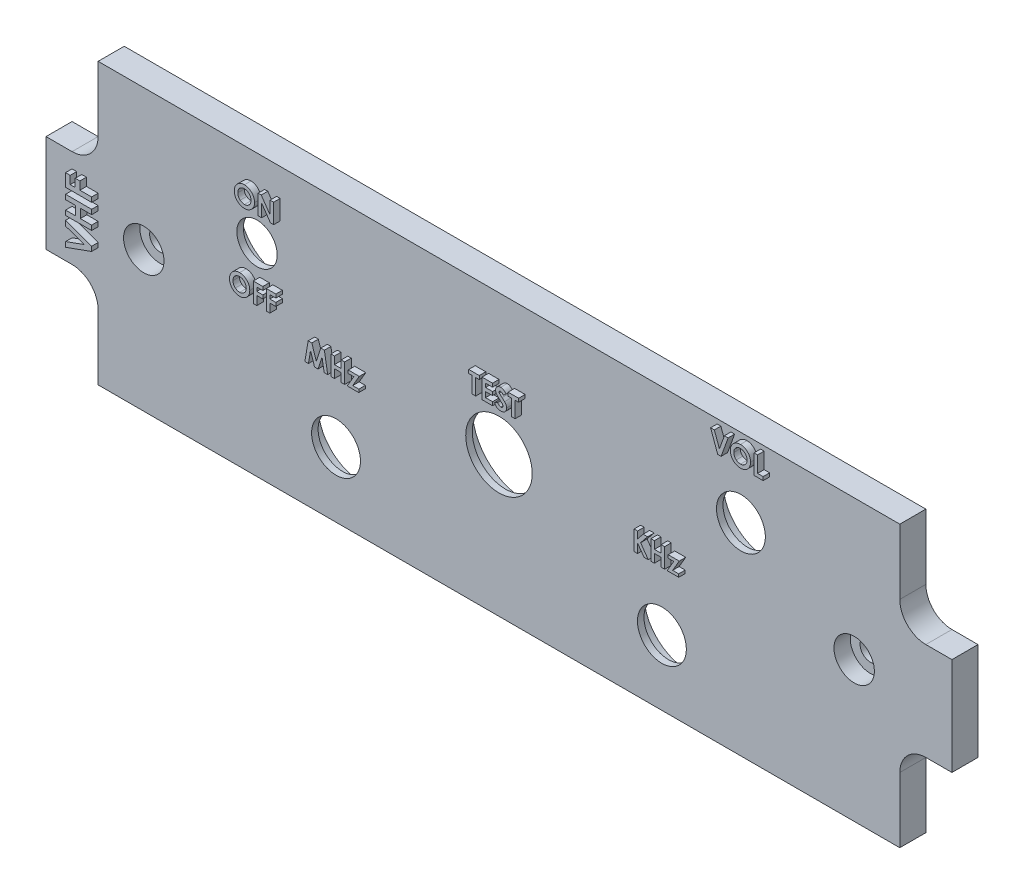
from build123d import *

# Parameters (mm, degrees)
SKETCH1_R            = 1.6
SKETCH1_R_2          = 3.75
SKETCH1_R_3          = 5.1
SKETCH1_R_4          = 3.1
BOSS_EXTRUDE1_DEPTH  = 4
SKETCH2_R            = 6.7
SKETCH2_R_2          = 6.75
SKETCH2_R_3          = 8.1
BACK_HOLES_DEPTH     = 3
SKETCH3_R            = 3.1
CAMA_TORNILLOS_DEPTH = 2.5
TEXTOS_DEPTH         = 1


with BuildPart() as part:
    # Sketch1 → Boss-Extrude1 (new body)
    with BuildSketch(Plane.XY):
        with BuildLine():
            Line((8, 0), (131, 0))
            Line((131, 0), (131, 10))
            ThreePointArc((131, 10), (132.171572875, 12.828427125), (135, 14))
            Line((135, 14), (139, 14))
            Line((139, 14), (139, 29))
            Line((139, 29), (135, 29))
            ThreePointArc((135, 29), (132.171572875, 30.171572875), (131, 33))
            Line((131, 33), (131, 43))
            Line((131, 43), (8, 43))
            Line((8, 43), (8, 33))
            ThreePointArc((8, 33), (6.828427125, 30.171572875), (4, 29))
            Line((4, 29), (0, 29))
            Line((0, 29), (0, 14))
            Line((0, 14), (4, 14))
            ThreePointArc((4, 14), (6.828427125, 12.828427125), (8, 10))
            Line((8, 10), (8, 0))
        make_face()
        with Locations((124, 21.5)):
            Circle(SKETCH1_R, mode=Mode.SUBTRACT)
        with Locations((106.624355653, 31)):
            Circle(SKETCH1_R_2, mode=Mode.SUBTRACT)
        with Locations((94.5, 10)):
            Circle(SKETCH1_R_2, mode=Mode.SUBTRACT)
        with Locations((69.5, 21.5)):
            Circle(SKETCH1_R_3, mode=Mode.SUBTRACT)
        with Locations((44.5, 10)):
            Circle(SKETCH1_R_2, mode=Mode.SUBTRACT)
        with Locations((32.375644347, 31)):
            Circle(SKETCH1_R_4, mode=Mode.SUBTRACT)
        with Locations((15, 21.5)):
            Circle(SKETCH1_R, mode=Mode.SUBTRACT)
    extrude(amount=BOSS_EXTRUDE1_DEPTH)

    # Sketch2 → Back holes (cut)
    with BuildSketch(Plane(origin=(0, 0, 0), x_dir=(-1, 0, 0), z_dir=(0, 0, -1))):
        with Locations((-32.375644347, 31)):
            Circle(SKETCH2_R)
        with Locations((-44.5, 10)):
            Circle(SKETCH2_R_2)
        with Locations((-69.5, 21.5)):
            Circle(SKETCH2_R_3)
        with Locations((-94.5, 10)):
            Circle(SKETCH2_R_2)
        with Locations((-106.624355653, 31)):
            Circle(SKETCH2_R_2)
    extrude(amount=-BACK_HOLES_DEPTH, mode=Mode.SUBTRACT)

    # Sketch3 → Cama tornillos (cut)
    with BuildSketch(Plane.XY.offset(4)):
        with Locations((124, 21.5)):
            Circle(SKETCH3_R)
        with Locations((15, 21.5)):
            Circle(SKETCH3_R)
    extrude(amount=-CAMA_TORNILLOS_DEPTH, mode=Mode.SUBTRACT)

    # Sketch4 → Textos (add)
    # profile 1 of 21: a face of its own
    with BuildSketch(Plane.XY.offset(4)):
        Polygon((4, 24.757985016), (4, 26.706702964), (4.717948718, 26.706702964), (4.717948718, 25.475933734), (5.487179487, 25.475933734), (5.487179487, 26.706702964), (6.205128205, 26.706702964), (6.205128205, 25.475933734), (8, 25.475933734), (8, 24.757985016), align=None)
    # profile 2 of 21: a face of its own
    with BuildSketch(Plane.XY.offset(4)):
        Polygon((4, 21.014395272), (4, 21.73234399), (5.538461538, 21.73234399), (5.538461538, 23.116959375), (4, 23.116959375), (4, 23.834908093), (8, 23.834908093), (8, 23.116959375), (6.256410256, 23.116959375), (6.256410256, 21.73234399), (8, 21.73234399), (8, 21.014395272), align=None)
    # profile 3 of 21: a face of its own
    with BuildSketch(Plane.XY.offset(4)):
        Polygon((4, 16.783626041), (4, 17.550452964), (6.841346154, 18.578497836), (4, 19.60734399), (4, 20.373369631), (8, 18.9238504), (8, 18.231542708), align=None)
    # profile 4 of 21: a face of its own
    with BuildSketch(Plane.XY.offset(4)):
        with BuildLine():
            add(Edge.make_bspline(
                [(30.712754657, 26.785286662), (30.764913334, 26.78393618), (30.867886376, 26.781270024), (31.01932256, 26.759045529), (31.165259325, 26.722833901), (31.305630677, 26.672497118), (31.440085143, 26.606671806), (31.569096989, 26.527224155), (31.6922041, 26.432654637), (31.808144973, 26.325169404), (31.915295251, 26.208283907), (32.008141029, 26.082435889), (32.087316502, 25.950886198), (32.152937346, 25.813282343), (32.202919833, 25.668671352), (32.237994611, 25.51779055), (32.260528419, 25.360682861), (32.263120153, 25.253713939), (32.26443735, 25.199349162)],
                knots=[0, 0, 0, 0, 1.014329547, 2.002516266, 2.970391464, 3.935626869, 4.897733899, 5.877609409, 6.878433252, 7.912639331, 8.949961323, 9.958554974, 10.949718813, 11.932905612, 12.9188844, 13.919928257, 14.942845884, 16, 16, 16, 16], degree=3))
            add(Edge.make_bspline(
                [(32.26443735, 25.199349162), (32.263034593, 25.14559695), (32.260270415, 25.039676493), (32.23891454, 24.884016613), (32.203249098, 24.734752058), (32.154114353, 24.591544966), (32.089683623, 24.455088981), (32.012052158, 24.324512852), (31.91917141, 24.201028356), (31.814429107, 24.084701759), (31.69911692, 23.979110412), (31.576983009, 23.886058219), (31.448591312, 23.807209303), (31.314129754, 23.742599779), (31.173309988, 23.692458707), (31.026479857, 23.657080538), (30.873648446, 23.63558051), (30.769715675, 23.632834387), (30.716961388, 23.631440508)],
                knots=[0, 0, 0, 0, 1.051557043, 2.072126891, 3.067553643, 4.050577992, 5.02905126, 6.015227836, 7.017913613, 8.04756643, 9.074058332, 10.072836633, 11.047628519, 12.017157415, 12.98668631, 13.966869689, 14.968021931, 16, 16, 16, 16], degree=3))
            add(Edge.make_bspline(
                [(30.716961388, 23.631440508), (30.661786729, 23.632690886), (30.553376066, 23.635147709), (30.394716576, 23.658510971), (30.242707075, 23.693704206), (30.09862453, 23.74622822), (29.961001585, 23.811887654), (29.830849395, 23.892751185), (29.708211699, 23.988685177), (29.593791969, 24.097232727), (29.490127416, 24.216007554), (29.398623114, 24.341482627), (29.321437206, 24.472699425), (29.258566866, 24.609719361), (29.209002417, 24.75169089), (29.174040329, 24.899478658), (29.153387389, 25.052728218), (29.150510555, 25.156818382), (29.149052734, 25.209565508)],
                knots=[0, 0, 0, 0, 1.067978421, 2.098431617, 3.099715153, 4.085208694, 5.062210972, 6.048429807, 7.046490867, 8.072918869, 9.098532598, 10.095778865, 11.076610158, 12.041847152, 13.011192615, 13.984257998, 14.978533688, 16, 16, 16, 16], degree=3))
            add(Edge.make_bspline(
                [(29.149052734, 25.209565508), (29.149510282, 25.245051013), (29.150419585, 25.315572694), (29.16137309, 25.420082226), (29.177142987, 25.522551873), (29.200465918, 25.622573086), (29.228797318, 25.720851468), (29.265504648, 25.81647222), (29.307287524, 25.910456835), (29.35610688, 26.001695236), (29.410389284, 26.089347954), (29.46961622, 26.173001516), (29.533936612, 26.251644428), (29.603143265, 26.325793498), (29.677474672, 26.39496134), (29.755953082, 26.460127121), (29.840100518, 26.519559806), (29.928075257, 26.574710859), (30.019381319, 26.624583), (30.113647003, 26.667032675), (30.208930251, 26.704103253), (30.30650392, 26.733360992), (30.405322332, 26.757191115), (30.506441163, 26.772950384), (30.608946862, 26.783903585), (30.67806994, 26.784824542), (30.712754657, 26.785286662)],
                knots=[0, 0, 0, 0, 1.034744296, 2.056386356, 3.06226378, 4.057406941, 5.050368692, 6.043467995, 7.042652155, 8.049140477, 9.059438543, 10.048523776, 11.036952808, 12.020949711, 13.004946614, 13.997082645, 14.994316842, 16.007702937, 17.024872941, 18.026463647, 19.021641123, 20.005082605, 20.995858141, 21.984425357, 22.988620895, 24, 24, 24, 24], degree=3))
        make_face()
        with BuildLine():
            add(Edge.make_bspline(
                [(30.704341196, 26.246825123), (30.669238413, 26.245883237), (30.599959568, 26.24402433), (30.498340118, 26.229861973), (30.400781857, 26.207243079), (30.307825589, 26.174479888), (30.219068435, 26.13278066), (30.134353054, 26.082291099), (30.05485258, 26.021275682), (29.97950695, 25.953010055), (29.911444573, 25.876946458), (29.851309315, 25.795431378), (29.80098579, 25.708600943), (29.758839522, 25.617261788), (29.727112724, 25.520386829), (29.704514676, 25.418734897), (29.690233554, 25.31213084), (29.688433401, 25.239458994), (29.687514273, 25.202353969)],
                knots=[0, 0, 0, 0, 1.033739768, 2.040188636, 3.016340934, 3.979330865, 4.937572243, 5.900995986, 6.878200029, 7.884839167, 8.891893314, 9.879764717, 10.863503415, 11.843163062, 12.837761627, 13.859916423, 14.907309254, 16, 16, 16, 16], degree=3))
            add(Edge.make_bspline(
                [(29.687514273, 25.202353969), (29.688732896, 25.161233255), (29.691121196, 25.080643469), (29.707925565, 24.96308126), (29.736676168, 24.852055422), (29.77819148, 24.748108966), (29.829681358, 24.650087643), (29.893623614, 24.559192845), (29.968982688, 24.474880335), (30.027038707, 24.42565518), (30.056504657, 24.400671277)],
                knots=[0, 0, 0, 0, 1.078454662, 2.113592447, 3.107694534, 4.079536787, 5.043276885, 6.005368276, 6.987637804, 8, 8, 8, 8], degree=3))
            add(Edge.make_bspline(
                [(30.056504657, 24.400671277), (30.080642896, 24.382214129), (30.128375535, 24.345715675), (30.204567219, 24.29893542), (30.28302965, 24.258840074), (30.364354927, 24.226443509), (30.448371294, 24.200960916), (30.53506723, 24.183115874), (30.624319894, 24.171916568), (30.684676728, 24.170578038), (30.715158504, 24.169902046)],
                knots=[0, 0, 0, 0, 1.023928204, 2.024787132, 3.009472467, 3.9914905, 4.972207045, 5.96565515, 6.972602802, 8, 8, 8, 8], degree=3))
            add(Edge.make_bspline(
                [(30.715158504, 24.169902046), (30.749657693, 24.170851919), (30.817535933, 24.172720823), (30.917263682, 24.186708834), (31.012805894, 24.210381598), (31.104755705, 24.242857379), (31.19284797, 24.285080176), (31.276652161, 24.337135765), (31.356315207, 24.39838497), (31.431564847, 24.467547074), (31.500346575, 24.543910309), (31.560356343, 24.625860183), (31.612279905, 24.711591093), (31.65354974, 24.802316432), (31.686529993, 24.897179794), (31.708856061, 24.99660131), (31.723257827, 25.100171124), (31.725058487, 25.170654044), (31.725975811, 25.2065607)],
                knots=[0, 0, 0, 0, 1.026359118, 2.019393844, 2.989460624, 3.950973911, 4.916101784, 5.890408035, 6.881132271, 7.902007068, 8.92769091, 9.933912415, 10.920395702, 11.90457117, 12.894218921, 13.903490204, 14.931958862, 16, 16, 16, 16], degree=3))
            add(Edge.make_bspline(
                [(31.725975811, 25.2065607), (31.725026747, 25.242260883), (31.72315866, 25.31253125), (31.70914603, 25.415834787), (31.685623392, 25.514817386), (31.653050089, 25.609640694), (31.611455707, 25.700397674), (31.560020034, 25.786769171), (31.498923551, 25.868671684), (31.42957239, 25.945547079), (31.354087914, 26.016190643), (31.273047786, 26.077496415), (31.188719601, 26.130769182), (31.099168458, 26.172500916), (31.006226499, 26.2057485), (30.909326588, 26.230232498), (30.808101708, 26.243924838), (30.73923633, 26.245849744), (30.704341196, 26.246825123)],
                knots=[0, 0, 0, 0, 1.055025985, 2.07665775, 3.074803781, 4.057872707, 5.035505728, 6.020516407, 7.023567878, 8.050795229, 9.077271434, 10.074415901, 11.050397877, 12.019801805, 12.988065821, 13.964604439, 14.968634123, 16, 16, 16, 16], degree=3))
        make_face(mode=Mode.SUBTRACT)
    # profile 5 of 21: a face of its own
    with BuildSketch(Plane.XY.offset(4)):
        Polygon((32.802898888, 26.708363585), (34.26443735, 26.708363585), (34.26443735, 26.169902046), (33.341360427, 26.169902046), (33.341360427, 25.592978969), (34.26443735, 25.592978969), (34.26443735, 25.054517431), (33.341360427, 25.054517431), (33.341360427, 23.708363585), (32.802898888, 23.708363585), align=None)
    # profile 6 of 21: a face of its own
    with BuildSketch(Plane.XY.offset(4)):
        Polygon((34.802898888, 26.708363585), (36.26443735, 26.708363585), (36.26443735, 26.169902046), (35.341360427, 26.169902046), (35.341360427, 25.592978969), (36.26443735, 25.592978969), (36.26443735, 25.054517431), (35.341360427, 25.054517431), (35.341360427, 23.708363585), (34.802898888, 23.708363585), align=None)
    # profile 7 of 21: a face of its own
    with BuildSketch(Plane.XY.offset(4)):
        with BuildLine():
            add(Edge.make_bspline(
                [(31.449469455, 38.822294619), (31.501628132, 38.820944138), (31.604601173, 38.818277981), (31.756037358, 38.796053486), (31.901974123, 38.759841858), (32.042345475, 38.709505076), (32.176799941, 38.643679764), (32.305811787, 38.564232112), (32.428918898, 38.469662595), (32.544859771, 38.362177362), (32.652010049, 38.245291865), (32.744855827, 38.119443846), (32.8240313, 37.987894155), (32.889652144, 37.850290301), (32.939634631, 37.70567931), (32.974709409, 37.554798508), (32.997243217, 37.397690819), (32.999834951, 37.290721896), (33.001152148, 37.236357119)],
                knots=[0, 0, 0, 0, 1.014329547, 2.002516266, 2.970391464, 3.935626869, 4.897733899, 5.877609409, 6.878433252, 7.912639331, 8.949961323, 9.958554974, 10.949718813, 11.932905612, 12.9188844, 13.919928257, 14.942845884, 16, 16, 16, 16], degree=3))
            add(Edge.make_bspline(
                [(33.001152148, 37.236357119), (32.99974939, 37.182604908), (32.996985213, 37.07668445), (32.975629338, 36.92102457), (32.939963896, 36.771760016), (32.890829151, 36.628552924), (32.826398421, 36.492096939), (32.748766956, 36.36152081), (32.655886208, 36.238036313), (32.551143904, 36.121709717), (32.435831718, 36.016118369), (32.313697806, 35.923066177), (32.185306109, 35.84421726), (32.050844551, 35.779607737), (31.910024786, 35.729466665), (31.763194655, 35.694088495), (31.610363244, 35.672588467), (31.506430473, 35.669842345), (31.453676186, 35.668448465)],
                knots=[0, 0, 0, 0, 1.051557043, 2.072126891, 3.067553643, 4.050577992, 5.02905126, 6.015227836, 7.017913613, 8.04756643, 9.074058332, 10.072836633, 11.047628519, 12.017157415, 12.98668631, 13.966869689, 14.968021931, 16, 16, 16, 16], degree=3))
            add(Edge.make_bspline(
                [(31.453676186, 35.668448465), (31.398501527, 35.669698844), (31.290090864, 35.672155667), (31.131431374, 35.695518929), (30.979421873, 35.730712163), (30.835339328, 35.783236178), (30.697716383, 35.848895612), (30.567564193, 35.929759142), (30.444926497, 36.025693135), (30.330506767, 36.134240685), (30.226842214, 36.253015512), (30.135337912, 36.378490584), (30.058152003, 36.509707383), (29.995281664, 36.646727319), (29.945717214, 36.788698847), (29.910755127, 36.936486616), (29.890102187, 37.089736175), (29.887225352, 37.19382634), (29.885767532, 37.246573465)],
                knots=[0, 0, 0, 0, 1.067978421, 2.098431617, 3.099715153, 4.085208694, 5.062210972, 6.048429807, 7.046490867, 8.072918869, 9.098532598, 10.095778865, 11.076610158, 12.041847152, 13.011192615, 13.984257998, 14.978533688, 16, 16, 16, 16], degree=3))
            add(Edge.make_bspline(
                [(29.885767532, 37.246573465), (29.88622508, 37.28205897), (29.887134383, 37.352580652), (29.898087887, 37.457090184), (29.913857785, 37.559559831), (29.937180716, 37.659581043), (29.965512116, 37.757859426), (30.002219446, 37.853480178), (30.044002322, 37.947464792), (30.092821678, 38.038703193), (30.147104082, 38.126355911), (30.206331018, 38.210009473), (30.27065141, 38.288652385), (30.339858062, 38.362801456), (30.41418947, 38.431969298), (30.49266788, 38.497135079), (30.576815316, 38.556567764), (30.664790055, 38.611718817), (30.756096116, 38.661590958), (30.850361801, 38.704040633), (30.945645049, 38.74111121), (31.043218717, 38.77036895), (31.14203713, 38.794199072), (31.243155961, 38.809958341), (31.34566166, 38.820911543), (31.414784738, 38.8218325), (31.449469455, 38.822294619)],
                knots=[0, 0, 0, 0, 1.034744296, 2.056386356, 3.06226378, 4.057406941, 5.050368692, 6.043467995, 7.042652155, 8.049140477, 9.059438543, 10.048523776, 11.036952808, 12.020949711, 13.004946614, 13.997082645, 14.994316842, 16.007702937, 17.024872941, 18.026463647, 19.021641123, 20.005082605, 20.995858141, 21.984425357, 22.988620895, 24, 24, 24, 24], degree=3))
        make_face()
        with BuildLine():
            add(Edge.make_bspline(
                [(31.441055994, 38.283833081), (31.405953211, 38.282891194), (31.336674365, 38.281032287), (31.235054915, 38.26686993), (31.137496655, 38.244251037), (31.044540387, 38.211487845), (30.955783233, 38.169788618), (30.871067852, 38.119299057), (30.791567378, 38.05828364), (30.716221748, 37.990018013), (30.648159371, 37.913954416), (30.588024113, 37.832439335), (30.537700588, 37.745608901), (30.49555432, 37.654269746), (30.463827522, 37.557394786), (30.441229474, 37.455742854), (30.426948352, 37.349138798), (30.425148199, 37.276466952), (30.424229071, 37.239361927)],
                knots=[0, 0, 0, 0, 1.033739768, 2.040188636, 3.016340934, 3.979330865, 4.937572243, 5.900995986, 6.878200029, 7.884839167, 8.891893314, 9.879764717, 10.863503415, 11.843163062, 12.837761627, 13.859916423, 14.907309254, 16, 16, 16, 16], degree=3))
            add(Edge.make_bspline(
                [(30.424229071, 37.239361927), (30.425447694, 37.198241213), (30.427835994, 37.117651427), (30.444640363, 37.000089218), (30.473390966, 36.88906338), (30.514906278, 36.785116923), (30.566396156, 36.6870956), (30.630338412, 36.596200802), (30.705697485, 36.511888293), (30.763753505, 36.462663138), (30.793219455, 36.437679235)],
                knots=[0, 0, 0, 0, 1.078454662, 2.113592447, 3.107694534, 4.079536787, 5.043276885, 6.005368276, 6.987637804, 8, 8, 8, 8], degree=3))
            add(Edge.make_bspline(
                [(30.793219455, 36.437679235), (30.817357694, 36.419222087), (30.865090333, 36.382723633), (30.941282017, 36.335943377), (31.019744448, 36.295848032), (31.101069725, 36.263451467), (31.185086092, 36.237968873), (31.271782028, 36.220123832), (31.361034692, 36.208924525), (31.421391526, 36.207585996), (31.451873301, 36.206910004)],
                knots=[0, 0, 0, 0, 1.023928204, 2.024787132, 3.009472467, 3.9914905, 4.972207045, 5.96565515, 6.972602802, 8, 8, 8, 8], degree=3))
            add(Edge.make_bspline(
                [(31.451873301, 36.206910004), (31.486372491, 36.207859877), (31.554250731, 36.209728781), (31.65397848, 36.223716791), (31.749520692, 36.247389556), (31.841470503, 36.279865337), (31.929562768, 36.322088134), (32.013366959, 36.374143723), (32.093030005, 36.435392928), (32.168279645, 36.504555032), (32.237061373, 36.580918267), (32.297071141, 36.66286814), (32.348994703, 36.748599051), (32.390264538, 36.83932439), (32.423244791, 36.934187752), (32.445570859, 37.033609267), (32.459972624, 37.137179082), (32.461773285, 37.207662001), (32.462690609, 37.243568658)],
                knots=[0, 0, 0, 0, 1.026359118, 2.019393844, 2.989460624, 3.950973911, 4.916101784, 5.890408035, 6.881132271, 7.902007068, 8.92769091, 9.933912415, 10.920395702, 11.90457117, 12.894218921, 13.903490204, 14.931958862, 16, 16, 16, 16], degree=3))
            add(Edge.make_bspline(
                [(32.462690609, 37.243568658), (32.461741545, 37.279268841), (32.459873458, 37.349539207), (32.445860827, 37.452842745), (32.42233819, 37.551825343), (32.389764887, 37.646648652), (32.348170505, 37.737405632), (32.296734832, 37.823777128), (32.235638349, 37.905679641), (32.166287188, 37.982555037), (32.090802712, 38.053198601), (32.009762584, 38.114504373), (31.925434399, 38.167777139), (31.835883256, 38.209508873), (31.742941297, 38.242756458), (31.646041385, 38.267240456), (31.544816506, 38.280932796), (31.475951128, 38.282857702), (31.441055994, 38.283833081)],
                knots=[0, 0, 0, 0, 1.055025985, 2.07665775, 3.074803781, 4.057872707, 5.035505728, 6.020516407, 7.023567878, 8.050795229, 9.077271434, 10.074415901, 11.050397877, 12.019801805, 12.988065821, 13.964604439, 14.968634123, 16, 16, 16, 16], degree=3))
        make_face(mode=Mode.SUBTRACT)
    # profile 8 of 21: a face of its own
    with BuildSketch(Plane.XY.offset(4)):
        Polygon((33.539613686, 38.745371542), (34.024589648, 38.745371542), (35.385767532, 36.771212889), (35.385767532, 38.745371542), (35.924229071, 38.745371542), (35.924229071, 35.745371542), (35.43564734, 35.745371542), (34.078075224, 37.713520581), (34.078075224, 35.745371542), (33.539613686, 35.745371542), align=None)
    # profile 9 of 21: a face of its own
    with BuildSketch(Plane.XY.offset(4)):
        Polygon((65.860000352, 31.489076254), (67.475384967, 31.489076254), (67.475384967, 30.950614716), (66.936923429, 30.950614716), (66.936923429, 28.489076254), (66.39846189, 28.489076254), (66.39846189, 30.950614716), (65.860000352, 30.950614716), align=None)
    # profile 10 of 21: a face of its own
    with BuildSketch(Plane.XY.offset(4)):
        Polygon((67.89846189, 31.489076254), (69.513846506, 31.489076254), (69.513846506, 30.950614716), (68.436923429, 30.950614716), (68.436923429, 30.373691639), (69.513846506, 30.373691639), (69.513846506, 29.8352301), (68.436923429, 29.8352301), (68.436923429, 29.027537793), (69.513846506, 29.027537793), (69.513846506, 28.489076254), (67.89846189, 28.489076254), align=None)
    # profile 11 of 21: a face of its own
    with BuildSketch(Plane.XY.offset(4)):
        with BuildLine():
            Line((71.590769583, 31.088234908), (71.188125352, 30.719845485))
            add(Edge.make_bspline(
                [(71.188125352, 30.719845485), (71.1708778, 30.744174951), (71.137764904, 30.790884132), (71.084092355, 30.853428826), (71.030662165, 30.906784105), (70.976979335, 30.950727075), (70.922568042, 30.984990749), (70.867522736, 31.009249809), (70.812155484, 31.024671524), (70.774957237, 31.026591898), (70.756634967, 31.027537793)],
                knots=[0, 0, 0, 0, 1.299362458, 2.494594718, 3.587462134, 4.587049575, 5.512617175, 6.380583204, 7.202344345, 8, 8, 8, 8], degree=3))
            add(Edge.make_bspline(
                [(70.756634967, 31.027537793), (70.739544479, 31.026938431), (70.706547237, 31.02578122), (70.659507221, 31.014278629), (70.617744424, 30.994426847), (70.581299606, 30.968468972), (70.552429934, 30.937195751), (70.529379739, 30.904398182), (70.516400542, 30.868197084), (70.514692224, 30.84333271), (70.513846506, 30.83102337)],
                knots=[0, 0, 0, 0, 1.185010067, 2.2879431, 3.333075148, 4.379039566, 5.372662701, 6.27520591, 7.14612461, 8, 8, 8, 8], degree=3))
            add(Edge.make_bspline(
                [(70.513846506, 30.83102337), (70.514376475, 30.818536523), (70.515443759, 30.79338975), (70.525752268, 30.756534021), (70.541290134, 30.720521684), (70.5561372, 30.698599261), (70.563726314, 30.687393562)],
                knots=[0, 0, 0, 0, 0.967525499, 1.948461899, 2.951351359, 4, 4, 4, 4], degree=3))
            add(Edge.make_bspline(
                [(70.563726314, 30.687393562), (70.570625639, 30.678683489), (70.586506974, 30.658634052), (70.616789427, 30.626878868), (70.654817829, 30.587975989), (70.702055592, 30.543263169), (70.756541747, 30.491132362), (70.820801797, 30.43363285), (70.892986059, 30.368983938), (70.944292959, 30.323964777), (70.971178237, 30.300374331)],
                knots=[0, 0, 0, 0, 0.473873513, 1.090794244, 1.870441696, 2.795289791, 3.865433203, 5.087734844, 6.473946851, 8, 8, 8, 8], degree=3))
            add(Edge.make_bspline(
                [(70.971178237, 30.300374331), (70.996413937, 30.278534105), (71.044306053, 30.237085894), (71.112447025, 30.178256814), (71.17233159, 30.125329724), (71.22483213, 30.079098948), (71.269152788, 30.039079419), (71.305479889, 30.005079844), (71.334257106, 29.977762133), (71.350615269, 29.961262218), (71.357596506, 29.954220485)],
                knots=[0, 0, 0, 0, 1.543621617, 2.929473131, 4.163658386, 5.240097082, 6.164993805, 6.925417477, 7.541396219, 8, 8, 8, 8], degree=3))
            add(Edge.make_bspline(
                [(71.357596506, 29.954220485), (71.384081864, 29.925557655), (71.434996024, 29.87045763), (71.501166483, 29.78506992), (71.555626911, 29.701714105), (71.597758531, 29.618821708), (71.629578025, 29.535196759), (71.652011189, 29.448788359), (71.665446561, 29.358693595), (71.666938201, 29.297214917), (71.66769266, 29.266119524)],
                knots=[0, 0, 0, 0, 1.206664779, 2.319633467, 3.337109185, 4.282041471, 5.190008762, 6.099243693, 7.03861361, 8, 8, 8, 8], degree=3))
            add(Edge.make_bspline(
                [(71.66769266, 29.266119524), (71.667155655, 29.235820877), (71.666102032, 29.176373804), (71.653197174, 29.089381867), (71.634795604, 29.006126809), (71.606343549, 28.927514561), (71.571666352, 28.852254727), (71.528193478, 28.781519617), (71.477140547, 28.714593362), (71.418626051, 28.65267235), (71.353902069, 28.596483324), (71.284479448, 28.546462526), (71.209679337, 28.505163986), (71.130140817, 28.471157583), (71.045906463, 28.444965398), (70.957076625, 28.425606931), (70.863515429, 28.413988285), (70.799536936, 28.412773693), (70.766851314, 28.412153177)],
                knots=[0, 0, 0, 0, 1.043214005, 2.046824704, 3.02475056, 3.976699089, 4.921714032, 5.875962561, 6.831408892, 7.817874052, 8.806269674, 9.781291748, 10.760897367, 11.74438705, 12.757449933, 13.795994037, 14.874007457, 16, 16, 16, 16], degree=3))
            add(Edge.make_bspline(
                [(70.766851314, 28.412153177), (70.741193378, 28.412608366), (70.690375952, 28.413509901), (70.615478748, 28.420870184), (70.54315703, 28.432748898), (70.473492264, 28.449774643), (70.406170596, 28.47134857), (70.341189263, 28.497700297), (70.278996851, 28.529238264), (70.219122783, 28.565313926), (70.161858122, 28.607202521), (70.106478777, 28.65404765), (70.053534831, 28.706569814), (70.002772002, 28.764644799), (69.954515087, 28.82843706), (69.907184462, 28.897058171), (69.862883644, 28.971781646), (69.835517058, 29.024200769), (69.821538814, 29.050975293)],
                knots=[0, 0, 0, 0, 1.016823716, 2.013894106, 2.979844003, 3.91962641, 4.853723003, 5.779685073, 6.695824784, 7.614987388, 8.547259901, 9.504950863, 10.487499108, 11.500346958, 12.559593716, 13.656357062, 14.802919212, 16, 16, 16, 16], degree=3))
            Line((69.821538814, 29.050975293), (70.295096506, 29.3352301))
            add(Edge.make_bspline(
                [(70.295096506, 29.3352301), (70.312581201, 29.304837517), (70.346100855, 29.246572338), (70.402903043, 29.168285684), (70.461093985, 29.101246124), (70.522019002, 29.046638586), (70.584937271, 29.003732898), (70.6501527, 28.973069516), (70.717711109, 28.954088918), (70.763728829, 28.951770948), (70.786683044, 28.950614716)],
                knots=[0, 0, 0, 0, 1.283663364, 2.460892379, 3.537111102, 4.529833553, 5.449777664, 6.316464042, 7.160231139, 8, 8, 8, 8], degree=3))
            add(Edge.make_bspline(
                [(70.786683044, 28.950614716), (70.810030768, 28.951558958), (70.855328752, 28.953390925), (70.919985828, 28.970312251), (70.979265884, 28.996879974), (71.030507126, 29.034788452), (71.073894979, 29.078540597), (71.105917705, 29.127216858), (71.126034598, 29.179883398), (71.128161441, 29.216469041), (71.129231121, 29.234869524)],
                knots=[0, 0, 0, 0, 1.13588714, 2.203786484, 3.234766741, 4.283437687, 5.291419208, 6.222934724, 7.106237994, 8, 8, 8, 8], degree=3))
            add(Edge.make_bspline(
                [(71.129231121, 29.234869524), (71.128243315, 29.251988178), (71.126236682, 29.286763085), (71.11145644, 29.33846778), (71.088350413, 29.390148961), (71.061014354, 29.432539264), (71.033196491, 29.468031516), (71.00659634, 29.498783946), (70.974204393, 29.532759998), (70.93610278, 29.570002411), (70.892794925, 29.610839038), (70.844244345, 29.655265882), (70.789895086, 29.702891595), (70.751480922, 29.73533376), (70.731394583, 29.752297408)],
                knots=[0, 0, 0, 0, 0.916159276, 1.861089862, 2.860218735, 3.940849679, 4.552606315, 5.27541173, 6.11797699, 7.06649574, 8.129236253, 9.306560635, 10.591630461, 12, 12, 12, 12], degree=3))
            add(Edge.make_bspline(
                [(70.731394583, 29.752297408), (70.693209652, 29.784605522), (70.619921211, 29.84661457), (70.516355346, 29.938199983), (70.423033228, 30.023794943), (70.340760888, 30.104457591), (70.268490049, 30.178698276), (70.20671016, 30.247120007), (70.156099901, 30.310250566), (70.102843516, 30.385024488), (70.052239303, 30.47614165), (70.008502903, 30.585766159), (69.980128572, 30.695376759), (69.976949623, 30.768963278), (69.975384967, 30.805182024)],
                knots=[0, 0, 0, 0, 1.345494975, 2.582412109, 3.71882943, 4.751509156, 5.681369928, 6.505683931, 7.230279997, 7.856715994, 8.973648664, 10.023341002, 11.027102913, 12, 12, 12, 12], degree=3))
            add(Edge.make_bspline(
                [(69.975384967, 30.805182024), (69.976035706, 30.830866414), (69.97731773, 30.881467423), (69.988753582, 30.955868833), (70.005844898, 31.027659942), (70.030666396, 31.096578824), (70.062881704, 31.162539155), (70.102005944, 31.225863838), (70.148646641, 31.285970048), (70.201207559, 31.342817937), (70.259116232, 31.394770439), (70.320999009, 31.440623728), (70.386505627, 31.479352082), (70.455235351, 31.511480064), (70.527614068, 31.536071993), (70.60310857, 31.553503979), (70.681827138, 31.563871968), (70.735369809, 31.565281375), (70.762644583, 31.565999331)],
                knots=[0, 0, 0, 0, 1.010766082, 1.991317756, 2.957454644, 3.913069143, 4.869106762, 5.843196583, 6.838735724, 7.860187025, 8.887984031, 9.89767229, 10.887916223, 11.879572884, 12.879850636, 13.892031539, 14.926195476, 16, 16, 16, 16], degree=3))
            add(Edge.make_bspline(
                [(70.762644583, 31.565999331), (70.797991339, 31.564706272), (70.868405837, 31.562130359), (70.972515704, 31.541987566), (71.074205868, 31.510310903), (71.156149709, 31.472096493), (71.221350893, 31.435078176), (71.27132151, 31.400996373), (71.322169303, 31.361953836), (71.374304327, 31.317827532), (71.426757833, 31.267786062), (71.481021325, 31.213020705), (71.536355397, 31.153058158), (71.57231377, 31.110221192), (71.590769583, 31.088234908)],
                knots=[0, 0, 0, 0, 1.282922637, 2.555718331, 3.837320111, 5.142675274, 5.830281639, 6.55870424, 7.337177975, 8.157850921, 9.037902056, 9.96903443, 10.957596896, 12, 12, 12, 12], degree=3))
        make_face()
    # profile 12 of 21: a face of its own
    with BuildSketch(Plane.XY.offset(4)):
        Polygon((71.89846189, 31.489076254), (73.513846506, 31.489076254), (73.513846506, 30.950614716), (72.975384967, 30.950614716), (72.975384967, 28.489076254), (72.436923429, 28.489076254), (72.436923429, 30.950614716), (71.89846189, 30.950614716), align=None)
    # profile 13 of 21: a face of its own
    with BuildSketch(Plane.XY.offset(4)):
        Polygon((102.974106559, 42.295925538), (103.549226752, 42.295925538), (104.320260406, 40.164915922), (105.091895021, 42.295925538), (105.666414252, 42.295925538), (104.579274829, 39.295925538), (104.060044059, 39.295925538), align=None)
    # profile 14 of 21: a face of its own
    with BuildSketch(Plane.XY.offset(4)):
        with BuildLine():
            add(Edge.make_bspline(
                [(107.557039252, 42.372848615), (107.609197928, 42.371498133), (107.71217097, 42.368831977), (107.863607155, 42.346607482), (108.009543919, 42.310395854), (108.149915272, 42.260059072), (108.284369737, 42.194233759), (108.413381583, 42.114786108), (108.536488694, 42.02021659), (108.652429568, 41.912731358), (108.759579845, 41.79584586), (108.852425623, 41.669997842), (108.931601096, 41.538448151), (108.99722194, 41.400844296), (109.047204427, 41.256233305), (109.082279206, 41.105352503), (109.104813013, 40.948244814), (109.107404748, 40.841275892), (109.108721944, 40.786911115)],
                knots=[0, 0, 0, 0, 1.014329547, 2.002516266, 2.970391464, 3.935626869, 4.897733899, 5.877609409, 6.878433252, 7.912639331, 8.949961323, 9.958554974, 10.949718813, 11.932905612, 12.9188844, 13.919928257, 14.942845884, 16, 16, 16, 16], degree=3))
            add(Edge.make_bspline(
                [(109.108721944, 40.786911115), (109.107319187, 40.733158903), (109.104555009, 40.627238446), (109.083199134, 40.471578566), (109.047533692, 40.322314012), (108.998398948, 40.179106919), (108.933968218, 40.042650934), (108.856336752, 39.912074805), (108.763456005, 39.788590309), (108.658713701, 39.672263712), (108.543401514, 39.566672365), (108.421267603, 39.473620172), (108.292875906, 39.394771256), (108.158414348, 39.330161732), (108.017594582, 39.28002066), (107.870764451, 39.244642491), (107.71793304, 39.223142463), (107.61400027, 39.22039634), (107.561245982, 39.219002461)],
                knots=[0, 0, 0, 0, 1.051557043, 2.072126891, 3.067553643, 4.050577992, 5.02905126, 6.015227836, 7.017913613, 8.04756643, 9.074058332, 10.072836633, 11.047628519, 12.017157415, 12.98668631, 13.966869689, 14.968021931, 16, 16, 16, 16], degree=3))
            add(Edge.make_bspline(
                [(107.561245982, 39.219002461), (107.506071324, 39.220252839), (107.397660661, 39.222709662), (107.23900117, 39.246072924), (107.086991669, 39.281266159), (106.942909125, 39.333790173), (106.805286179, 39.399449608), (106.675133989, 39.480313138), (106.552496294, 39.57624713), (106.438076563, 39.68479468), (106.33441201, 39.803569508), (106.242907708, 39.92904458), (106.1657218, 40.060261378), (106.102851461, 40.197281314), (106.053287011, 40.339252843), (106.018324923, 40.487040611), (105.997671983, 40.640290171), (105.994795149, 40.744380335), (105.993337329, 40.797127461)],
                knots=[0, 0, 0, 0, 1.067978421, 2.098431617, 3.099715153, 4.085208694, 5.062210972, 6.048429807, 7.046490867, 8.072918869, 9.098532598, 10.095778865, 11.076610158, 12.041847152, 13.011192615, 13.984257998, 14.978533688, 16, 16, 16, 16], degree=3))
            add(Edge.make_bspline(
                [(105.993337329, 40.797127461), (105.993794877, 40.832612966), (105.994704179, 40.903134647), (106.005657684, 41.007644179), (106.021427582, 41.110113826), (106.044750512, 41.210135039), (106.073081912, 41.308413421), (106.109789242, 41.404034173), (106.151572118, 41.498018788), (106.200391475, 41.589257189), (106.254673879, 41.676909907), (106.313900814, 41.760563469), (106.378221207, 41.839206381), (106.447427859, 41.913355451), (106.521759266, 41.982523294), (106.600237676, 42.047689074), (106.684385112, 42.107121759), (106.772359852, 42.162272812), (106.863665913, 42.212144953), (106.957931597, 42.254594628), (107.053214846, 42.291665206), (107.150788514, 42.320922945), (107.249606926, 42.344753068), (107.350725757, 42.360512337), (107.453231456, 42.371465538), (107.522354534, 42.372386495), (107.557039252, 42.372848615)],
                knots=[0, 0, 0, 0, 1.034744296, 2.056386356, 3.06226378, 4.057406941, 5.050368692, 6.043467995, 7.042652155, 8.049140477, 9.059438543, 10.048523776, 11.036952808, 12.020949711, 13.004946614, 13.997082645, 14.994316842, 16.007702937, 17.024872941, 18.026463647, 19.021641123, 20.005082605, 20.995858141, 21.984425357, 22.988620895, 24, 24, 24, 24], degree=3))
        make_face()
        with BuildLine():
            add(Edge.make_bspline(
                [(107.54862579, 41.834387076), (107.513523008, 41.83344519), (107.444244162, 41.831586283), (107.342624712, 41.817423926), (107.245066451, 41.794805032), (107.152110184, 41.762041841), (107.063353029, 41.720342613), (106.978637648, 41.669853052), (106.899137174, 41.608837635), (106.823791545, 41.540572008), (106.755729167, 41.464508411), (106.695593909, 41.382993331), (106.645270384, 41.296162896), (106.603124117, 41.204823741), (106.571397318, 41.107948782), (106.548799271, 41.00629685), (106.534518148, 40.899692793), (106.532717995, 40.827020947), (106.531798867, 40.789915922)],
                knots=[0, 0, 0, 0, 1.033739768, 2.040188636, 3.016340934, 3.979330865, 4.937572243, 5.900995986, 6.878200029, 7.884839167, 8.891893314, 9.879764717, 10.863503415, 11.843163062, 12.837761627, 13.859916423, 14.907309254, 16, 16, 16, 16], degree=3))
            add(Edge.make_bspline(
                [(106.531798867, 40.789915922), (106.533017491, 40.748795208), (106.53540579, 40.668205422), (106.55221016, 40.550643214), (106.580960763, 40.439617375), (106.622476074, 40.335670919), (106.673965952, 40.237649596), (106.737908209, 40.146754798), (106.813267282, 40.062442288), (106.871323301, 40.013217133), (106.900789252, 39.98823323)],
                knots=[0, 0, 0, 0, 1.078454662, 2.113592447, 3.107694534, 4.079536787, 5.043276885, 6.005368276, 6.987637804, 8, 8, 8, 8], degree=3))
            add(Edge.make_bspline(
                [(106.900789252, 39.98823323), (106.92492749, 39.969776082), (106.972660129, 39.933277629), (107.048851813, 39.886497373), (107.127314245, 39.846402027), (107.208639521, 39.814005462), (107.292655888, 39.788522869), (107.379351824, 39.770677827), (107.468604488, 39.759478521), (107.528961323, 39.758139992), (107.559443098, 39.757463999)],
                knots=[0, 0, 0, 0, 1.023928204, 2.024787132, 3.009472467, 3.9914905, 4.972207045, 5.96565515, 6.972602802, 8, 8, 8, 8], degree=3))
            add(Edge.make_bspline(
                [(107.559443098, 39.757463999), (107.593942287, 39.758413872), (107.661820527, 39.760282776), (107.761548276, 39.774270787), (107.857090489, 39.797943551), (107.949040299, 39.830419332), (108.037132565, 39.872642129), (108.120936755, 39.924697718), (108.200599802, 39.985946923), (108.275849442, 40.055109027), (108.34463117, 40.131472263), (108.404640938, 40.213422136), (108.456564499, 40.299153046), (108.497834335, 40.389878385), (108.530814587, 40.484741747), (108.553140655, 40.584163263), (108.567542421, 40.687733078), (108.569343081, 40.758215997), (108.570260406, 40.794122653)],
                knots=[0, 0, 0, 0, 1.026359118, 2.019393844, 2.989460624, 3.950973911, 4.916101784, 5.890408035, 6.881132271, 7.902007068, 8.92769091, 9.933912415, 10.920395702, 11.90457117, 12.894218921, 13.903490204, 14.931958862, 16, 16, 16, 16], degree=3))
            add(Edge.make_bspline(
                [(108.570260406, 40.794122653), (108.569311342, 40.829822837), (108.567443254, 40.900093203), (108.553430624, 41.00339674), (108.529907986, 41.102379339), (108.497334684, 41.197202647), (108.455740301, 41.287959627), (108.404304628, 41.374331124), (108.343208145, 41.456233637), (108.273856984, 41.533109032), (108.198372508, 41.603752596), (108.117332381, 41.665058368), (108.033004195, 41.718331135), (107.943453053, 41.760062869), (107.850511094, 41.793310453), (107.753611182, 41.817794451), (107.652386303, 41.831486792), (107.583520924, 41.833411697), (107.54862579, 41.834387076)],
                knots=[0, 0, 0, 0, 1.055025985, 2.07665775, 3.074803781, 4.057872707, 5.035505728, 6.020516407, 7.023567878, 8.050795229, 9.077271434, 10.074415901, 11.050397877, 12.019801805, 12.988065821, 13.964604439, 14.968634123, 16, 16, 16, 16], degree=3))
        make_face(mode=Mode.SUBTRACT)
    # profile 15 of 21: a face of its own
    with BuildSketch(Plane.XY.offset(4)):
        Polygon((109.647183482, 42.295925538), (110.185645021, 42.295925538), (110.185645021, 39.834387076), (111.031798867, 39.834387076), (111.031798867, 39.295925538), (109.647183482, 39.295925538), align=None)
    # profile 16 of 21: a face of its own
    with BuildSketch(Plane.XY.offset(4)):
        Polygon((41.22688513, 22.976234432), (41.784577438, 22.976234432), (42.470274553, 20.883686355), (43.159577438, 22.976234432), (43.713063015, 22.976234432), (44.220274553, 19.976234432), (43.675202438, 19.976234432), (43.354889938, 21.871066163), (42.731091861, 19.976234432), (42.206452438, 19.976234432), (41.585659169, 21.871066163), (41.26594763, 19.976234432), (40.720274553, 19.976234432), align=None)
    # profile 17 of 21: a face of its own
    with BuildSketch(Plane.XY.offset(4)):
        Polygon((44.720274553, 22.976234432), (45.258736092, 22.976234432), (45.258736092, 21.822388278), (46.29719763, 21.822388278), (46.29719763, 22.976234432), (46.835659169, 22.976234432), (46.835659169, 19.976234432), (46.29719763, 19.976234432), (46.29719763, 21.28392674), (45.258736092, 21.28392674), (45.258736092, 19.976234432), (44.720274553, 19.976234432), align=None)
    # profile 18 of 21: a face of its own
    with BuildSketch(Plane.XY.offset(4)):
        Polygon((47.374120707, 22.168542124), (49.066428399, 22.168542124), (48.058615899, 20.437772894), (48.989505322, 20.437772894), (48.989505322, 19.976234432), (47.220274553, 19.976234432), (48.227486092, 21.707003663), (47.374120707, 21.707003663), align=None)
    # profile 19 of 21: a face of its own
    with BuildSketch(Plane.XY.offset(4)):
        Polygon((91.233249776, 22.976234432), (91.771711314, 22.976234432), (91.771711314, 21.920345009), (92.622672853, 22.976234432), (93.302360353, 22.976234432), (92.233249776, 21.649311355), (93.406326699, 19.976234432), (92.757889199, 19.976234432), (91.771711314, 21.383085394), (91.771711314, 19.976234432), (91.233249776, 19.976234432), align=None)
    # profile 20 of 21: a face of its own
    with BuildSketch(Plane.XY.offset(4)):
        Polygon((93.810172853, 22.976234432), (94.348634391, 22.976234432), (94.348634391, 21.822388278), (95.387095929, 21.822388278), (95.387095929, 22.976234432), (95.925557468, 22.976234432), (95.925557468, 19.976234432), (95.387095929, 19.976234432), (95.387095929, 21.28392674), (94.348634391, 21.28392674), (94.348634391, 19.976234432), (93.810172853, 19.976234432), align=None)
    # profile 21 of 21: a face of its own
    with BuildSketch(Plane.XY.offset(4)):
        Polygon((96.464019006, 22.168542124), (98.156326699, 22.168542124), (97.148514199, 20.437772894), (98.079403622, 20.437772894), (98.079403622, 19.976234432), (96.310172853, 19.976234432), (97.317384391, 21.707003663), (96.464019006, 21.707003663), align=None)
    extrude(amount=TEXTOS_DEPTH)


solid = part.part
